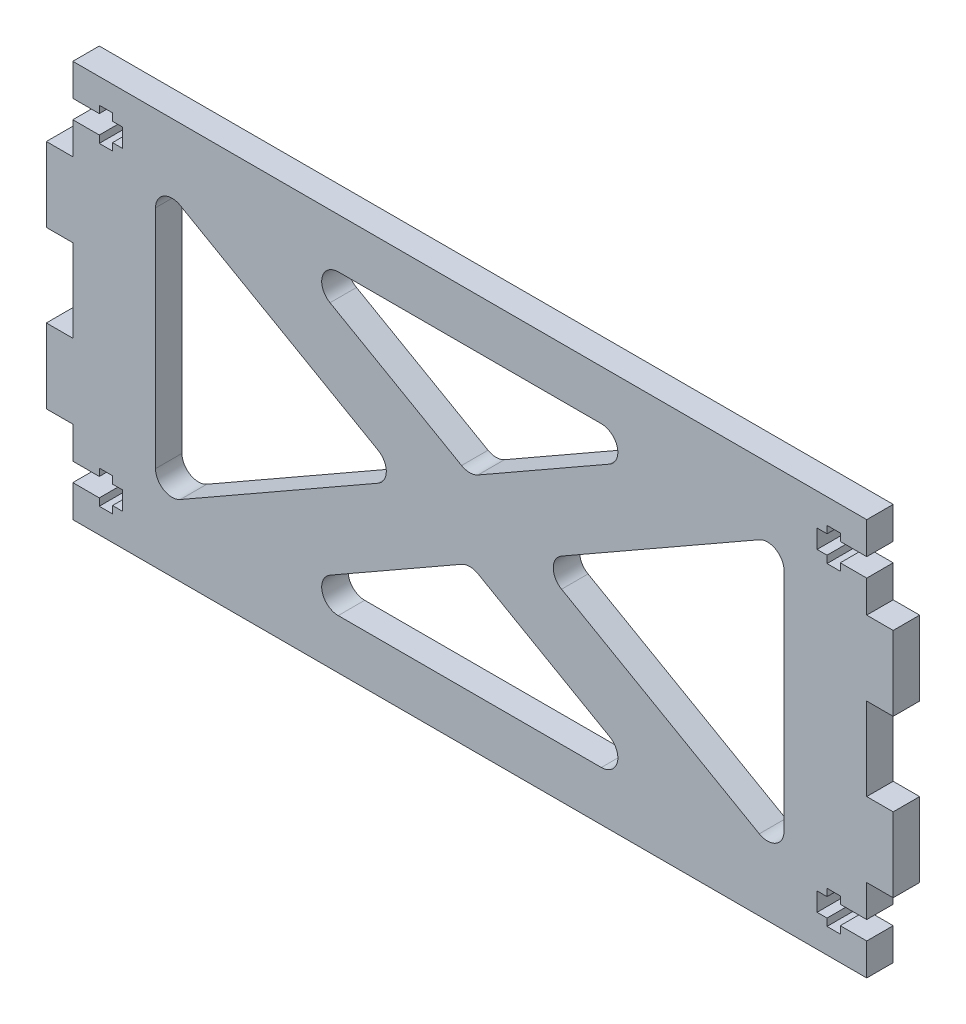
from build123d import *

# Parameters (mm, degrees)
SKETCH_1_W          = 120
SKETCH_1_H          = 60
SKETCH_1_W_2        = 4
SKETCH_1_H_2        = 11.25
EXTRUDE_1_DEPTH     = 4
SKETCH_2_W          = 7.5
SKETCH_2_H          = 2.8
SKETCH_2_W_2        = 2
SKETCH_2_H_2        = 5
CUT_EXTRUDE_1_DEPTH = 4
CUT_EXTRUDE_2_DEPTH = 71.795480082
FILLET_1_R          = 2.5


with BuildPart() as part:
    # Эскиз1 → Бобышка-Вытянуть1 (new body)
    with BuildSketch(Plane.XY):
        Rectangle(SKETCH_1_W, SKETCH_1_H)
        with Locations((-62, -11.875)):
            Rectangle(SKETCH_1_W_2, SKETCH_1_H_2)
        with Locations((-62, 11.875)):
            Rectangle(SKETCH_1_W_2, SKETCH_1_H_2)
        with Locations((62, 11.875)):
            Rectangle(SKETCH_1_W_2, SKETCH_1_H_2)
        with Locations((62, -11.875)):
            Rectangle(SKETCH_1_W_2, SKETCH_1_H_2)
    extrude(amount=EXTRUDE_1_DEPTH)

    # Эскиз2 → Вырез-Вытянуть1 (cut)
    with BuildSketch(Plane.XY.offset(4)):
        with Locations((-56.25, 23.75)):
            Rectangle(SKETCH_2_W, SKETCH_2_H)
        with Locations((-55, 23.75)):
            Rectangle(SKETCH_2_W_2, SKETCH_2_H_2)
        with Locations((55, 23.75)):
            Rectangle(SKETCH_2_W_2, SKETCH_2_H_2)
        with Locations((56.25, 23.75)):
            Rectangle(SKETCH_2_W, SKETCH_2_H)
        with Locations((56.25, -23.75)):
            Rectangle(SKETCH_2_W, SKETCH_2_H)
        with Locations((55, -23.75)):
            Rectangle(SKETCH_2_W_2, SKETCH_2_H_2)
        with Locations((-55, -23.75)):
            Rectangle(SKETCH_2_W_2, SKETCH_2_H_2)
        with Locations((-56.25, -23.75)):
            Rectangle(SKETCH_2_W, SKETCH_2_H)
    extrude(amount=-CUT_EXTRUDE_1_DEPTH, mode=Mode.SUBTRACT)

    # Эскиз3 → Вырез-Вытянуть2 (cut, through all)
    with BuildSketch(Plane.XY.offset(4)):
        Polygon((-47.5, 21.384101608), (-10.077822185, 0), (-47.5, -21.384101608), align=None)
        Polygon((-29.297177815, 22.5), (0, 5.758755534), (29.297177815, 22.5), align=None)
        Polygon((47.5, -21.384101608), (10.077822185, 0), (47.5, 21.384101608), align=None)
        Polygon((-29.297177815, -22.5), (0, -5.758755534), (29.297177815, -22.5), align=None)
    extrude(amount=-CUT_EXTRUDE_2_DEPTH, mode=Mode.SUBTRACT)

    # Скругление1
    fillet_1_edges = [part.edges().sort_by_distance(p)[0] for p in [
        (47.5, -21.384101608, 2),
        (10.077822185, 0, 2),
        (47.5, 21.384101608, 2),
        (0, 5.758755534, 2),
        (-29.297177815, 22.5, 2),
        (29.297177815, 22.5, 2),
        (-29.297177815, -22.5, 2),
        (0, -5.758755534, 2),
        (29.297177815, -22.5, 2),
        (-47.5, 21.384101608, 2),
        (-10.077822185, 0, 2),
        (-47.5, -21.384101608, 2),
    ]]
    fillet(fillet_1_edges, radius=FILLET_1_R)


solid = part.part
